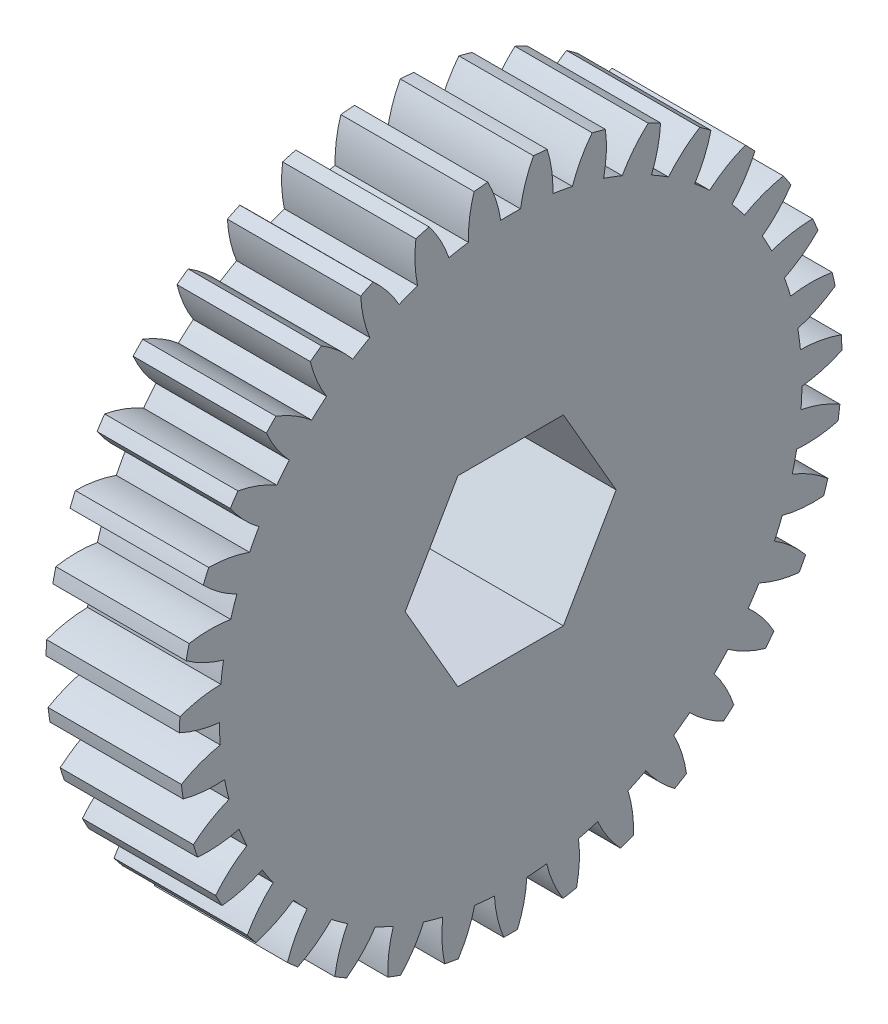
from build123d import *

# Parameters (mm, degrees)
BASPROSKE_W             = 9.4488
BASPROSKE_H             = 23.495
TOOTHCUT_DEPTH          = 35.544317499
TEETHCUTS_COUNT         = 35
TEETHCUTS_ANGLE         = 349.714285714
BORSKE_R                = 0.396875
BORE_DEPTH              = 50.8000508
SKETCH4_R               = 9.525
BOSS_EXTRUDE2_DEPTH     = 1.5875
CUT_EXTRUDE3_DEPTH      = 35.539654069
CUT_EXTRUDE3_DEPTH_BACK = 35.539654069


with BuildPart() as part:
    # BasProSke → Base-Revolve (revolve)
    with BuildSketch(Plane(origin=(0, 0, 0), x_dir=(1, 0, 0), z_dir=(0, 1, 0)), mode=Mode.PRIVATE) as base_revolve_sk:
        with Locations((4.7244, 11.7475)):
            Rectangle(BASPROSKE_W, BASPROSKE_H)
    revolve(base_revolve_sk.sketch.rotate(Axis((-10, 0, 0), (1, 0, 0)), 180), axis=Axis((-10, 0, 0), (1, 0, 0)))

    # TooCutSke → ToothCut (cut, through all)
    with BuildSketch(Plane(origin=(0, 0, 0), x_dir=(0, 0, -1), z_dir=(1, 0, 0))):
        with BuildLine():
            ThreePointArc((0.703368342, 20.638217777), (0, 20.6502), (-0.703368342, 20.638217777))
            ThreePointArc((-0.703368342, 20.638217777), (-1.049549413, 22.090093813), (-1.633752051, 23.463590313))
            ThreePointArc((-1.633752051, 23.463590313), (0, 23.5204), (1.633752051, 23.463590313))
            ThreePointArc((1.633752051, 23.463590313), (1.049549413, 22.090093813), (0.703368342, 20.638217777))
        make_face()
    toothcut = extrude(amount=TOOTHCUT_DEPTH, mode=Mode.SUBTRACT)

    # TeethCuts: ToothCut ×35 about axis
    teethcuts_axis = Axis((-10, 0, 0), (1, 0, 0))
    for i in range(1, TEETHCUTS_COUNT):
        add(toothcut.rotate(teethcuts_axis, i * TEETHCUTS_ANGLE / (TEETHCUTS_COUNT - 1)), mode=Mode.SUBTRACT)

    # BorSke → Bore (cut, symmetric)
    with BuildSketch(Plane(origin=(0, 0, 0), x_dir=(0, 0, -1), z_dir=(1, 0, 0))):
        with Locations(Location((0, 0, 0), (0, 0, 180))):
            Circle(BORSKE_R)
    extrude(amount=BORE_DEPTH, both=True, mode=Mode.SUBTRACT)

    # Sketch4 → Boss-Extrude2 (add)
    with BuildSketch(Plane.ZY):
        with Locations(Location((0, 0, 0), (0, 0, 180))):
            Circle(SKETCH4_R)
    extrude(amount=BOSS_EXTRUDE2_DEPTH)

    # Sketch2 → Cut-Extrude3 (cut, two sides: drawn at the far end of the back side and taken through both)
    with BuildSketch(Plane.ZY.offset(-CUT_EXTRUDE3_DEPTH_BACK)):
        Polygon((7.478995387, 0), (3.739497694, 6.477), (-3.739497694, 6.477), (-7.478995387, 0), (-3.739497694, -6.477), (3.739497694, -6.477), align=None)
    extrude(amount=CUT_EXTRUDE3_DEPTH + CUT_EXTRUDE3_DEPTH_BACK, mode=Mode.SUBTRACT)


solid = part.part
